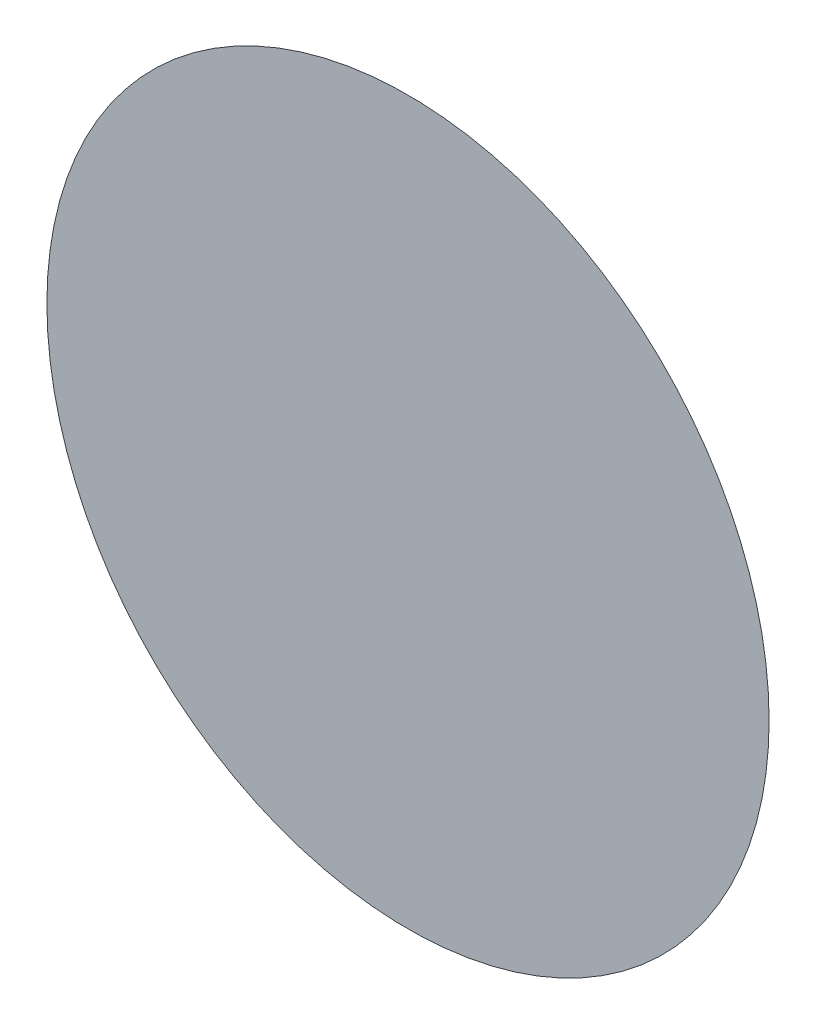
from build123d import *

# Parameters (mm, degrees)
CUT_EXTRUDE_1_DEPTH = 34.3


with BuildPart() as part:
    # 草图3 → 旋转1 (revolve)
    with BuildSketch(Plane(origin=(0, 0, 0), x_dir=(1, 0, 0), z_dir=(0, 1, 0))):
        Polygon((-100, 36.733070518), (0, 36.733070518), (0, -33.266929482), (-200, -33.266929482), align=None)
    revolve(axis=Axis((0, 0, -36.733070518), (0, 0, 1)))

    # 草图4 → 切除-拉伸1 (cut)
    with BuildSketch(Plane(origin=(0, 0, -36.733070518), x_dir=(-1, 0, 0), z_dir=(0, 0, -1))):
        with BuildLine():
            Line((-46.25, 13.747727085), (-46.25, -16.046690113))
            ThreePointArc((-46.25, -16.046690113), (0, -48.954660285), (46.25, -16.046690113))
            Line((46.25, -16.046690113), (46.25, 13.747727085))
            ThreePointArc((46.25, 13.747727085), (0, 48.25), (-46.25, 13.747727085))
        make_face()
    extrude(amount=-CUT_EXTRUDE_1_DEPTH, mode=Mode.SUBTRACT)


solid = part.part
